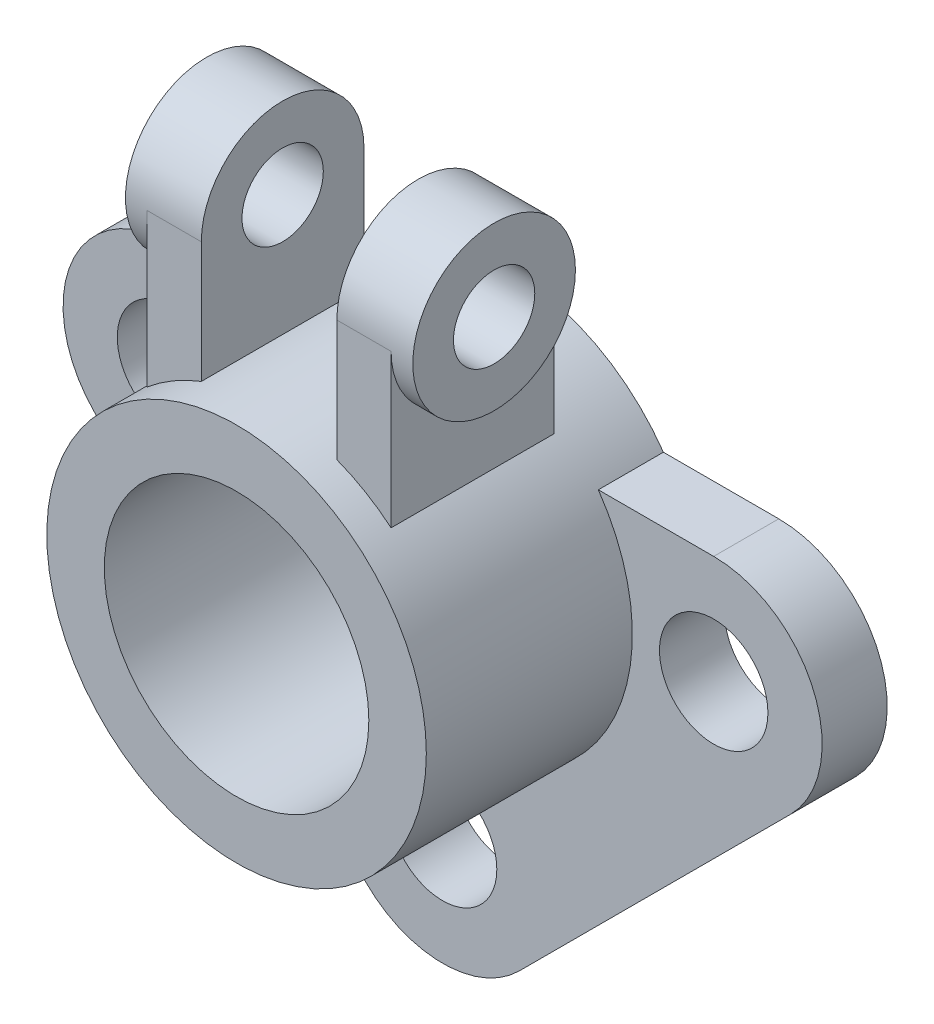
from build123d import *

# Parameters (mm, degrees)
SKETCH1_R                = 10
BOSS_EXTRUDE1_DEPTH      = 12
SKETCH1_3_R              = 35
SKETCH1_3_R_2            = 24.39675389
BOSS_EXTRUDE2_DEPTH      = 50
BOSS_EXTRUDE3_START      = 12.5
BOSS_EXTRUDE3_DEPTH      = 10
BOSS_EXTRUDE4_DEPTH      = 4
BOSS_EXTRUDE4_DEPTH_BACK = 10
SKETCH3_R                = 15
SKETCH4_R                = 7.5
CUT_EXTRUDE1_DEPTH       = 130.275867818


with BuildPart() as part:
    # Sketch1 → Boss-Extrude1 (new body)
    with BuildSketch(Plane.XY):
        with BuildLine():
            Line((-28.722813233, 20), (-50, 20))
            ThreePointArc((-50, 20), (-68.47759065, 7.653668647), (-64.142135624, -14.142135624))
            Line((-64.142135624, -14.142135624), (-14.142135624, -64.142135624))
            ThreePointArc((-14.142135624, -64.142135624), (0, -70), (14.142135624, -64.142135624))
            Line((14.142135624, -64.142135624), (64.142135624, -14.142135624))
            ThreePointArc((64.142135624, -14.142135624), (68.47759065, 7.653668647), (50, 20))
            Line((50, 20), (28.722813233, 20))
            ThreePointArc((28.722813233, 20), (33.393850206, 10.480971731), (35, 0))
            ThreePointArc((35, 0), (-10.480971731, -33.393850206), (-28.722813233, 20))
        make_face()
        with Locations((0, -50)):
            Circle(SKETCH1_R, mode=Mode.SUBTRACT)
        with Locations((-50, 0)):
            Circle(SKETCH1_R, mode=Mode.SUBTRACT)
        with Locations((50, 0)):
            Circle(SKETCH1_R, mode=Mode.SUBTRACT)
    extrude(amount=BOSS_EXTRUDE1_DEPTH)

    # Sketch1<3> → Boss-Extrude2 (add)
    with BuildSketch(Plane.XY):
        Circle(SKETCH1_3_R)
        Circle(SKETCH1_3_R_2, mode=Mode.SUBTRACT)
    extrude(amount=BOSS_EXTRUDE2_DEPTH)

    # Sketch2 → Boss-Extrude3 (add)
    with BuildSketch(Plane(origin=(0, 0, 0), x_dir=(0, 0, -1), z_dir=(1, 0, 0)).offset(BOSS_EXTRUDE3_START)):
        Polygon((-44, 35), (-44, 26.042981562), (-14, 26.042981562), (-14, 55), (-44, 55), align=None)
    extrude(amount=BOSS_EXTRUDE3_DEPTH)

    # Sketch3 → Boss-Extrude4 (add, two sides: drawn at the far end of the back side and taken through both)
    with BuildSketch(Plane(origin=(22.5, 0, 0), x_dir=(0, 0, -1), z_dir=(1, 0, 0)).offset(-BOSS_EXTRUDE4_DEPTH_BACK)):
        with Locations((-29, 55)):
            Circle(SKETCH3_R)
    extrude(amount=BOSS_EXTRUDE4_DEPTH + BOSS_EXTRUDE4_DEPTH_BACK)

    # Sketch4 → Cut-Extrude1 (cut, through all)
    with BuildSketch(Plane(origin=(26.5, 0, 0), x_dir=(0, 0, -1), z_dir=(1, 0, 0))):
        with Locations((-29, 55)):
            Circle(SKETCH4_R)
    extrude(amount=-CUT_EXTRUDE1_DEPTH, mode=Mode.SUBTRACT)

    # Mirror1: part across plane


with BuildPart() as part_1:
    add(part.part)
    add(part.part.mirror(Plane(origin=(0, 0, 0), x_dir=(0, 0, 1), z_dir=(1, 0, 0))))


solid = part_1.part
